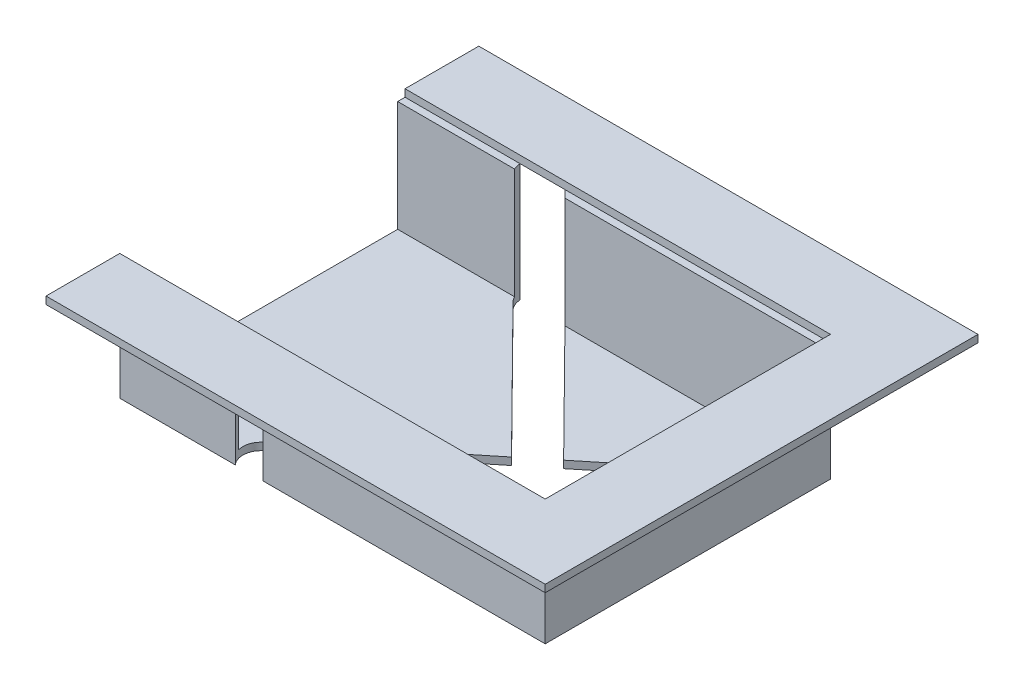
from build123d import *

# Parameters (mm, degrees)
SKETCH1_W           = 176
SKETCH1_H           = 116
BOSS_EXTRUDE1_DEPTH = 48
SHELL1_T            = -3
SKETCH2_W           = 236
SKETCH2_H           = 176
SKETCH2_W_2         = 176
SKETCH2_H_2         = 116
BOSS_EXTRUDE2_DEPTH = 3
CUT_EXTRUDE1_DEPTH  = 240.121603348
CUT_EXTRUDE2_DEPTH  = 240.121603348


with BuildPart() as part:
    # Sketch1 → Boss-Extrude1 (new body)
    with BuildSketch(Plane(origin=(0, 0, 0), x_dir=(1, 0, 0), z_dir=(0, 1, 0))):
        with Locations((74.983600324, 43.664236579)):
            Rectangle(SKETCH1_W, SKETCH1_H)
    extrude(amount=BOSS_EXTRUDE1_DEPTH)

    # Shell1
    shell1_openings = [part.faces().sort_by_distance(p)[0] for p in [
        (74.983600324, 48, -43.664236579),
    ]]
    offset(amount=SHELL1_T, openings=shell1_openings, kind=Kind.INTERSECTION)


with BuildPart() as body_2:
    # Sketch2 → Boss-Extrude2 (new body)
    with BuildSketch(Plane(origin=(0, 48, 0), x_dir=(1, 0, 0), z_dir=(0, 1, 0))):
        with Locations((74.983600324, 43.664236579)):
            Rectangle(SKETCH2_W, SKETCH2_H)
        with Locations((74.983600324, 43.664236579)):
            Rectangle(SKETCH2_W_2, SKETCH2_H_2, mode=Mode.SUBTRACT)
    extrude(amount=BOSS_EXTRUDE2_DEPTH)


with BuildPart() as cut_extrude1_tool:
    # Sketch5 → Cut-Extrude1 (new, through all)
    with BuildSketch(Plane(origin=(0, 51, 0), x_dir=(1, 0, 0), z_dir=(0, 1, 0))):
        Polygon((-10.016399676, -51.335763421), (-10.016399676, 131.664236579), (-43.016399676, 131.664236579), (-43.016399676, -84.335763421), (-10.016399676, -84.335763421), align=None)
    extrude(amount=-CUT_EXTRUDE1_DEPTH)


with BuildPart() as part_1:
    add(part.part)

    # Cut-Extrude1: cut by cut_extrude1_tool
    add(cut_extrude1_tool.part, mode=Mode.SUBTRACT)

    # Sketch6 → Cut-Extrude2 (cut, through all)
    with BuildSketch(Plane.XZ):
        with BuildLine():
            Line((47.265635004, 15.145139053), (148.160455019, -66.831902209))
            ThreePointArc((148.160455019, -66.831902209), (149.251865332, -77.382201898), (138.701565643, -78.473612211))
            Line((138.701565643, -78.473612211), (37.806745628, 3.503429052))
            ThreePointArc((37.806745628, 3.503429052), (36.715335315, 14.053728741), (47.265635004, 15.145139053))
        make_face()
        with BuildLine():
            Line((141.018508979, -14.716854507), (49.614998177, -107.158177589))
            ThreePointArc((49.614998177, -107.158177589), (39.008565453, -107.218051374), (38.948691668, -96.61161865))
            Line((38.948691668, -96.61161865), (130.35220247, -4.170295568))
            ThreePointArc((130.35220247, -4.170295568), (140.958635194, -4.110421783), (141.018508979, -14.716854507))
        make_face()
    extrude(amount=-CUT_EXTRUDE2_DEPTH, mode=Mode.SUBTRACT)


with BuildPart() as body_2_1:
    add(body_2.part)

    # Cut-Extrude1: cut by cut_extrude1_tool
    add(cut_extrude1_tool.part, mode=Mode.SUBTRACT)


with BuildPart() as cut_extrude2_piece_1:
    # of the separate pieces the step leaves, piece 1, a body of its own (cut_extrude2_pieces)
    add(part_1.part.solids().sort_by_distance((48.261789628, 0, 14.335763421))[0])


with BuildPart() as cut_extrude2_piece_2:
    # of the separate pieces the step leaves, piece 2, a body of its own (cut_extrude2_pieces)
    add(part_1.part.solids().sort_by_distance((-10.016399676, 0, 14.335763421))[0])


solid = Compound([body_2_1.part, cut_extrude2_piece_1.part, cut_extrude2_piece_2.part])
